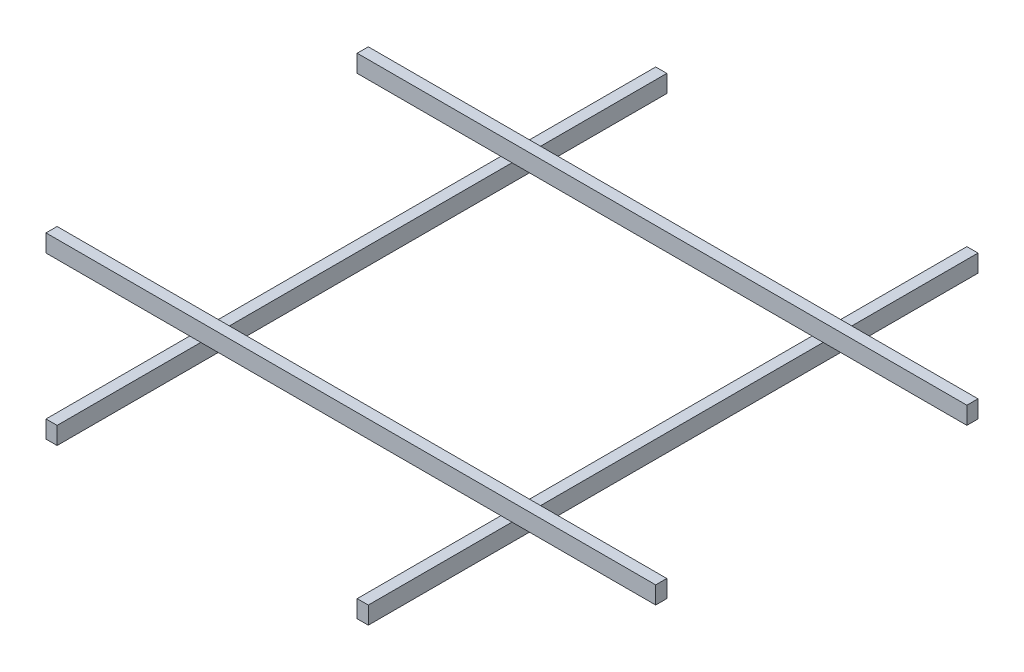
from build123d import *

# Parameters (mm, degrees)
SKETCH1_W              = 88.9
SKETCH1_H              = 139.7
PROFILES_4X6_1_DEPTH   = 4876.8
SKETCH1_ON_SEGMENT_2_W = 88.9
SKETCH1_ON_SEGMENT_2_H = 139.7
PROFILES_4X6_1_2_DEPTH = 4876.8
SKETCH1_ON_SEGMENT_3_W = 88.9
SKETCH1_ON_SEGMENT_3_H = 139.7
PROFILES_4X6_1_3_DEPTH = 4876.8
SKETCH1_ON_SEGMENT_4_W = 88.9
SKETCH1_ON_SEGMENT_4_H = 139.7
PROFILES_4X6_1_4_DEPTH = 4876.8


with BuildPart() as part:
    # Sketch1 → Profiles 4X6(1) (new body)
    with BuildSketch(Plane(origin=(889, 0, 0), x_dir=(-1, 0, 0), z_dir=(0, 0, -1))):
        Rectangle(SKETCH1_W, SKETCH1_H)
    extrude(amount=PROFILES_4X6_1_DEPTH)


with BuildPart() as body_2:
    # Sketch1 on segment 2 (carried to segment 2) → Profiles 4X6_1 2 (new body)
    with BuildSketch(Plane(origin=(3378.2, 0, 0), x_dir=(-1, 0, 0), z_dir=(0, 0, -1))):
        Rectangle(SKETCH1_ON_SEGMENT_2_W, SKETCH1_ON_SEGMENT_2_H)
    extrude(amount=PROFILES_4X6_1_2_DEPTH)


with BuildPart() as body_3:
    # Sketch1 on segment 3 (carried to segment 3) → Profiles 4X6_1 3 (new body)
    with BuildSketch(Plane(origin=(-304.8, 139.7, -3683), x_dir=(0, 0, -1), z_dir=(1, 0, 0))):
        Rectangle(SKETCH1_ON_SEGMENT_3_W, SKETCH1_ON_SEGMENT_3_H)
    extrude(amount=PROFILES_4X6_1_3_DEPTH)


with BuildPart() as body_4:
    # Sketch1 on segment 4 (carried to segment 4) → Profiles 4X6_1 4 (new body)
    with BuildSketch(Plane(origin=(4572, 139.7, -1193.8), x_dir=(0, 0, 1), z_dir=(-1, 0, 0))):
        Rectangle(SKETCH1_ON_SEGMENT_4_W, SKETCH1_ON_SEGMENT_4_H)
    extrude(amount=PROFILES_4X6_1_4_DEPTH)


solid = Compound([part.part, body_2.part, body_3.part, body_4.part])
